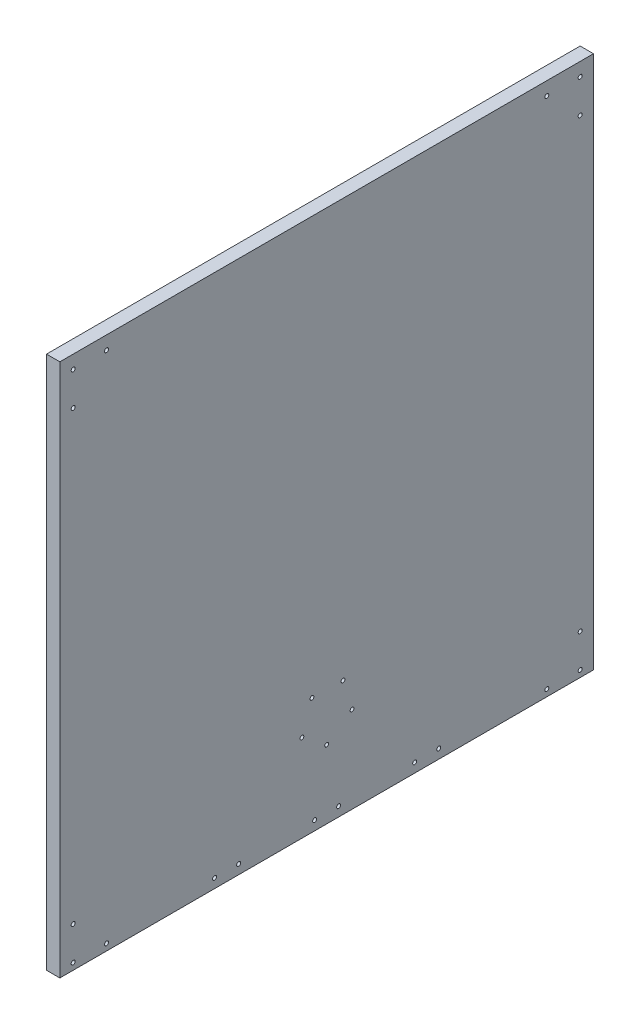
from build123d import *

# Parameters (mm, degrees)
SKETCH_1_W          = 400
SKETCH_1_H          = 400
EXTRUDE_1_DEPTH     = 10
SKETCH_2_R          = 1.5
CUT_EXTRUDE_1_DEPTH = 10
SKETCH_3_R          = 1.5
CUT_EXTRUDE_2_DEPTH = 10
SKETCH_4_R          = 1.45
CUT_EXTRUDE_3_DEPTH = 10


with BuildPart() as part:
    # 草图1 → 凸台-拉伸1 (new body)
    with BuildSketch(Plane(origin=(0, 0, 0), x_dir=(0, 0, -1), z_dir=(1, 0, 0))):
        Rectangle(SKETCH_1_W, SKETCH_1_H)
    extrude(amount=EXTRUDE_1_DEPTH)

    # 草图2 → 切除-拉伸1 (cut)
    with BuildSketch(Plane(origin=(10, 0, 0), x_dir=(0, 0, -1), z_dir=(1, 0, 0))):
        with Locations((190, 190)):
            Circle(SKETCH_2_R)
        with Locations((165, 190)):
            Circle(SKETCH_2_R)
        with Locations((190, 165)):
            Circle(SKETCH_2_R)
        with Locations((190, -195)):
            Circle(SKETCH_2_R)
        with Locations((165, -195)):
            Circle(SKETCH_2_R)
        with Locations((190, -170)):
            Circle(SKETCH_2_R)
    cut_extrude_1 = extrude(amount=-CUT_EXTRUDE_1_DEPTH, mode=Mode.SUBTRACT)

    # 草图3 → 切除-拉伸2 (cut)
    with BuildSketch(Plane(origin=(10, 0, 0), x_dir=(0, 0, -1), z_dir=(1, 0, 0))):
        with Locations((-84, -193)):
            Circle(SKETCH_3_R)
        with Locations((-66, -193)):
            Circle(SKETCH_3_R)
        with Locations((-9, -193)):
            Circle(SKETCH_3_R)
        with Locations((9, -193)):
            Circle(SKETCH_3_R)
        with Locations((66, -193)):
            Circle(SKETCH_3_R)
        with Locations((84, -193)):
            Circle(SKETCH_3_R)
    extrude(amount=-CUT_EXTRUDE_2_DEPTH, mode=Mode.SUBTRACT)

    # 镜向1: 切除-拉伸1 across plane
    add(cut_extrude_1.mirror(Plane.XY), mode=Mode.SUBTRACT)

    # 草图4 → 切除-拉伸3 (cut)
    with BuildSketch(Plane(origin=(10, 0, 0), x_dir=(0, 0, -1), z_dir=(1, 0, 0))):
        with Locations((-11.007896697, -112.622517601)):
            Circle(SKETCH_4_R)
        with Locations((12.238028253, -113.022211572)):
            Circle(SKETCH_4_R)
        with Locations((-18.571414113, -134.607193773)):
            Circle(SKETCH_4_R)
        with Locations((19.041282557, -135.253912204)):
            Circle(SKETCH_4_R)
        with Locations((0, -148.59416485)):
            Circle(SKETCH_4_R)
    extrude(amount=-CUT_EXTRUDE_3_DEPTH, mode=Mode.SUBTRACT)


solid = part.part
